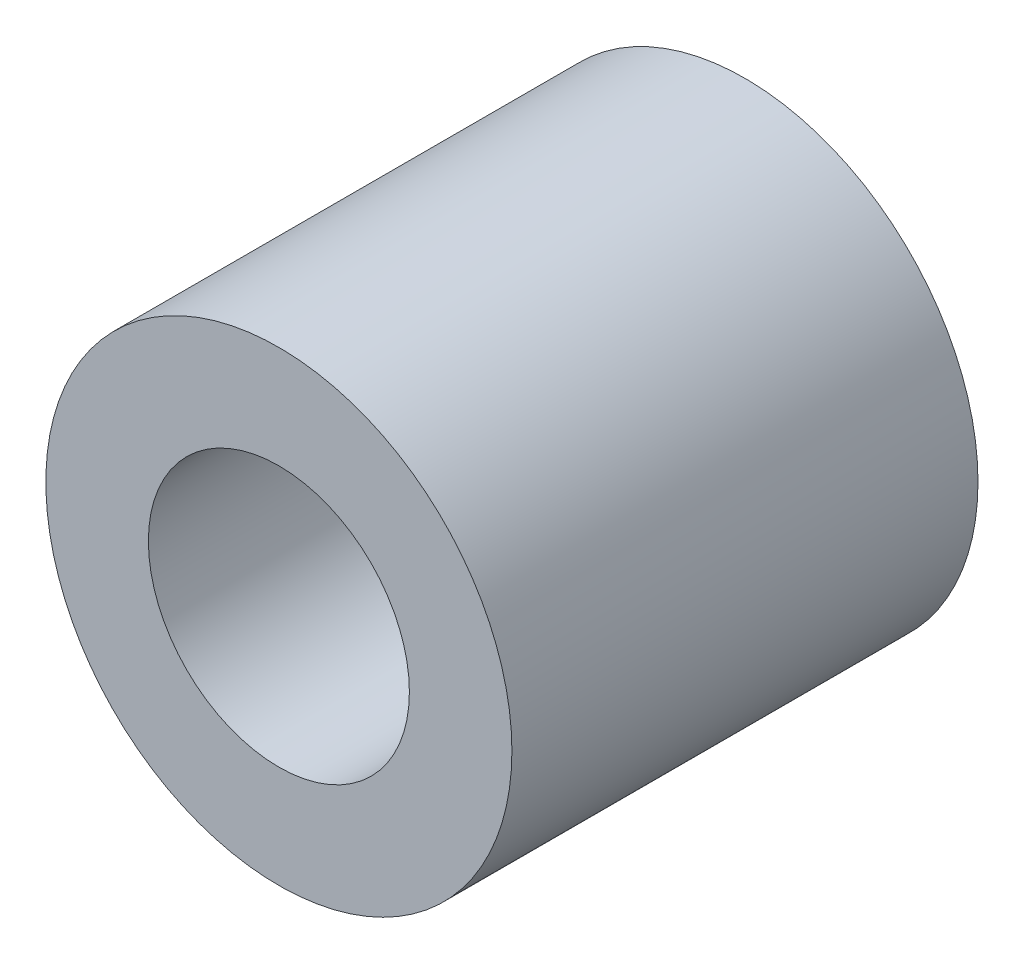
from build123d import *

# Parameters (mm, degrees)
SKETCH1_R           = 3.175
BOSS_EXTRUDE1_DEPTH = 6.35
SKETCH2_R           = 1.778
CUT_EXTRUDE1_DEPTH  = 6.35


with BuildPart() as part:
    # Sketch1 → Boss-Extrude1 (new body)
    with BuildSketch(Plane.XY):
        Circle(SKETCH1_R)
    extrude(amount=BOSS_EXTRUDE1_DEPTH)

    # Sketch2 → Cut-Extrude1 (cut)
    with BuildSketch(Plane.XY.offset(6.35)):
        Circle(SKETCH2_R)
    extrude(amount=-CUT_EXTRUDE1_DEPTH, mode=Mode.SUBTRACT)


solid = part.part
